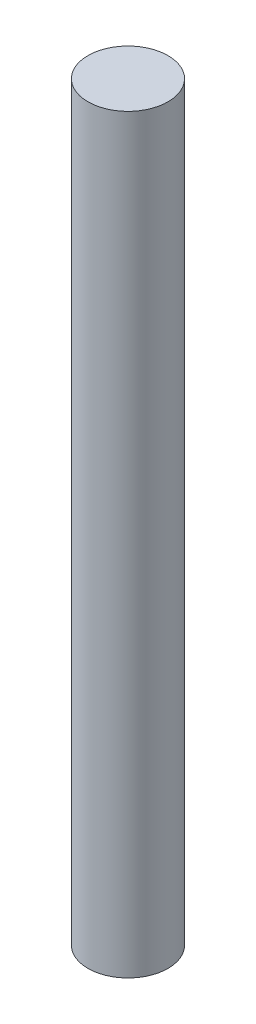
from build123d import *

# Parameters (mm, degrees)
SKETCH1_R           = 8
BOSS_EXTRUDE1_DEPTH = 75


with BuildPart() as part:
    # Sketch1 → Boss-Extrude1 (new, symmetric)
    with BuildSketch(Plane(origin=(0, 0, 0), x_dir=(1, 0, 0), z_dir=(0, 1, 0))):
        with Locations(Location((0, 0, 0), (0, 0, 270))):
            Circle(SKETCH1_R)
    extrude(amount=BOSS_EXTRUDE1_DEPTH, both=True)


solid = part.part
